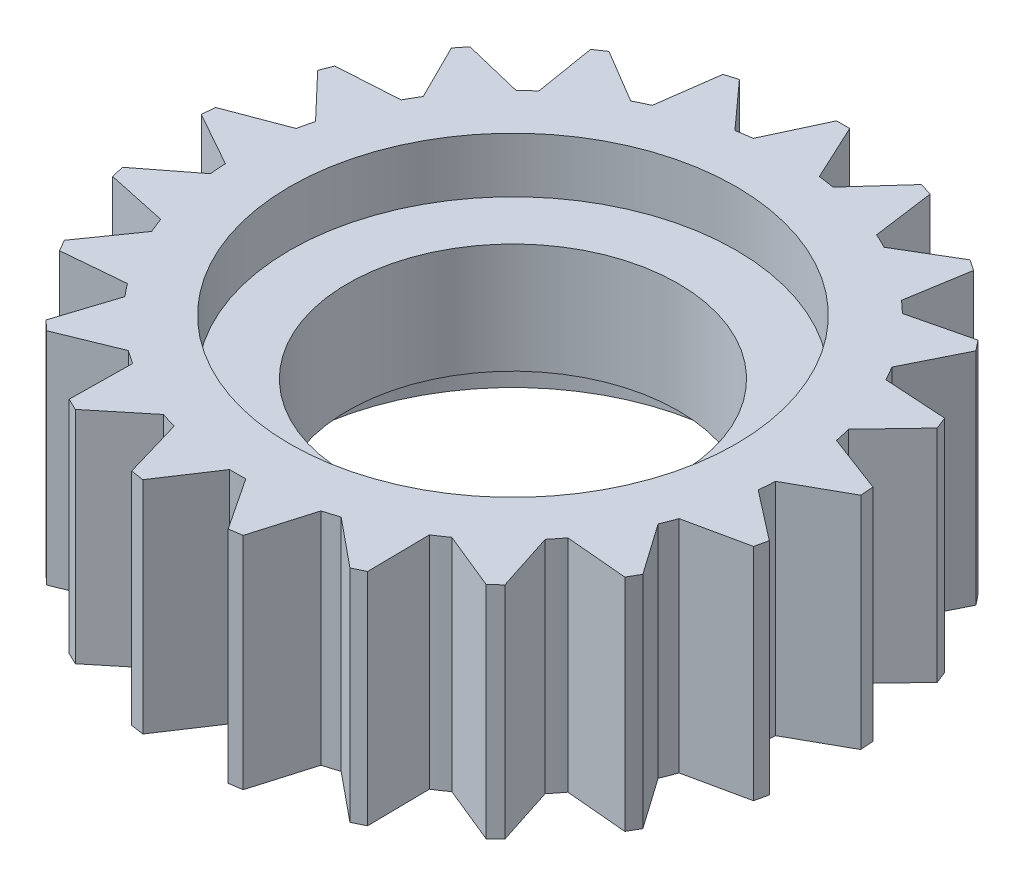
from build123d import *

# Parameters (mm, degrees)
CUT_EXTRUDE1_DEPTH      = 47.904157598
CUT_EXTRUDE1_DEPTH_BACK = 47.904157598
SKETCH2_R               = 30


with BuildPart() as part:
    # Sketch1 → Revolve1 (revolve)
    with BuildSketch(Plane(origin=(0, 0, 0), x_dir=(0, 0, -1), z_dir=(1, 0, 0))):
        Polygon((20.25, 10), (30, 10), (30, -10), (20.25, -10), (20.25, -5), (15, -5), (15, 5), (20.25, 5), align=None)
    revolve(axis=Axis((0, 0, 0), (0, 1, 0)))

    # Sketch2 → Cut-Extrude1 (cut, two sides: drawn at the far end of the back side and taken through both)
    with BuildSketch(Plane(origin=(0, 10, 0), x_dir=(1, 0, 0), z_dir=(0, 1, 0)).offset(-CUT_EXTRUDE1_DEPTH_BACK)):
        Circle(SKETCH2_R)
        with BuildLine():
            Line((-3, 24.819347292), (-0.6, 29.978082123))
            Line((-0.6, 29.978082123), (0.6, 29.978082123))
            Line((0.6, 29.978082123), (3, 24.819347292))
            ThreePointArc((3, 24.819347292), (3.726056654, 24.720770656), (4.448912622, 24.600958853))
            Line((4.448912622, 24.600958853), (8.262851141, 28.823093151))
            Line((8.262851141, 28.823093151), (9.409538508, 28.469386942))
            Line((9.409538508, 28.469386942), (10.182349457, 22.832427806))
            ThreePointArc((10.182349457, 22.832427806), (10.847093478, 22.524221698), (11.502519835, 22.19666726))
            Line((11.502519835, 22.19666726), (16.391511698, 25.107045865))
            Line((16.391511698, 25.107045865), (17.382998227, 24.431061795))
            Line((17.382998227, 24.431061795), (16.459952481, 18.816746912))
            ThreePointArc((16.459952481, 18.816746912), (17.004318444, 18.326296796), (17.534077682, 17.820104373))
            Line((17.534077682, 17.820104373), (23.063714507, 19.160127373))
            Line((23.063714507, 19.160127373), (23.811902269, 18.221929594))
            Line((23.811902269, 18.221929594), (21.275016493, 13.129115478))
            ThreePointArc((21.275016493, 13.129115478), (21.650635095, 12.5), (22.007655779, 11.86014701))
            Line((22.007655779, 11.86014701), (27.686605069, 11.510747481))
            Line((27.686605069, 11.510747481), (28.125014298, 10.393698982))
            Line((28.125014298, 10.393698982), (24.199701926, 6.274904518))
            ThreePointArc((24.199701926, 6.274904518), (24.373197805, 5.563023349), (24.525757082, 4.846363537))
            Line((24.525757082, 4.846363537), (29.849419269, 2.838587161))
            Line((29.849419269, 2.838587161), (29.939095382, 1.641942604))
            Line((29.939095382, 1.641942604), (24.974137644, -1.136859246))
            ThreePointArc((24.974137644, -1.136859246), (24.93009493, -1.86825234), (24.864637239, -2.598040603))
            Line((24.864637239, -2.598040603), (29.359981576, -6.085794085))
            Line((29.359981576, -6.085794085), (29.092956455, -7.25570758))
            Line((29.092956455, -7.25570758), (23.529511635, -8.447608076))
            ThreePointArc((23.529511635, -8.447608076), (23.271843716, -9.133525609), (22.99418526, -9.811597435))
            Line((22.99418526, -9.811597435), (26.261780675, -14.469425819))
            Line((26.261780675, -14.469425819), (25.661780675, -15.508656304))
            Line((25.661780675, -15.508656304), (19.99418526, -15.007749857))
            ThreePointArc((19.99418526, -15.007749857), (19.545787062, -15.587245046), (19.080599013, -16.153350777))
            Line((19.080599013, -16.153350777), (20.830105314, -21.567385572))
            Line((20.830105314, -21.567385572), (19.950443068, -22.383592857))
            Line((19.950443068, -22.383592857), (14.682287782, -20.234387203))
            ThreePointArc((14.682287782, -20.234387203), (14.083001452, -20.655969358), (13.471617809, -21.059808014))
            Line((13.471617809, -21.059808014), (13.547583684, -26.748988469))
            Line((13.547583684, -26.748988469), (12.466421042, -27.269648956))
            Line((12.466421042, -27.269648956), (8.065804602, -23.663110449))
            ThreePointArc((8.065804602, -23.663110449), (7.36887936, -23.889320145), (6.665624244, -24.095008891))
            Line((6.665624244, -24.095008891), (5.061299791, -29.553826355))
            Line((5.061299791, -29.553826355), (3.8747028, -29.732677074))
            Line((3.8747028, -29.732677074), (0.732639287, -24.989262488))
            ThreePointArc((0.732639287, -24.989262488), (0, -25), (-0.732639287, -24.989262488))
            Line((-0.732639287, -24.989262488), (-3.8747028, -29.732677074))
            Line((-3.8747028, -29.732677074), (-5.061299791, -29.553826355))
            Line((-5.061299791, -29.553826355), (-6.665624244, -24.095008891))
            ThreePointArc((-6.665624244, -24.095008891), (-7.36887936, -23.889320145), (-8.065804602, -23.663110449))
            Line((-8.065804602, -23.663110449), (-12.466421042, -27.269648956))
            Line((-12.466421042, -27.269648956), (-13.547583684, -26.748988469))
            Line((-13.547583684, -26.748988469), (-13.471617809, -21.059808014))
            ThreePointArc((-13.471617809, -21.059808014), (-14.083001452, -20.655969358), (-14.682287782, -20.234387203))
            Line((-14.682287782, -20.234387203), (-19.950443068, -22.383592857))
            Line((-19.950443068, -22.383592857), (-20.830105314, -21.567385572))
            Line((-20.830105314, -21.567385572), (-19.080599013, -16.153350777))
            ThreePointArc((-19.080599013, -16.153350777), (-19.545787062, -15.587245046), (-19.99418526, -15.007749857))
            Line((-19.99418526, -15.007749857), (-25.661780675, -15.508656304))
            Line((-25.661780675, -15.508656304), (-26.261780675, -14.469425819))
            Line((-26.261780675, -14.469425819), (-22.99418526, -9.811597435))
            ThreePointArc((-22.99418526, -9.811597435), (-23.271843716, -9.133525609), (-23.529511635, -8.447608076))
            Line((-23.529511635, -8.447608076), (-29.092956455, -7.25570758))
            Line((-29.092956455, -7.25570758), (-29.359981576, -6.085794085))
            Line((-29.359981576, -6.085794085), (-24.864637239, -2.598040603))
            ThreePointArc((-24.864637239, -2.598040603), (-24.93009493, -1.86825234), (-24.974137644, -1.136859246))
            Line((-24.974137644, -1.136859246), (-29.939095382, 1.641942604))
            Line((-29.939095382, 1.641942604), (-29.849419269, 2.838587161))
            Line((-29.849419269, 2.838587161), (-24.525757082, 4.846363537))
            ThreePointArc((-24.525757082, 4.846363537), (-24.373197805, 5.563023349), (-24.199701926, 6.274904518))
            Line((-24.199701926, 6.274904518), (-28.125014298, 10.393698982))
            Line((-28.125014298, 10.393698982), (-27.686605069, 11.510747481))
            Line((-27.686605069, 11.510747481), (-22.007655779, 11.86014701))
            ThreePointArc((-22.007655779, 11.86014701), (-21.650635095, 12.5), (-21.275016493, 13.129115478))
            Line((-21.275016493, 13.129115478), (-23.811902269, 18.221929594))
            Line((-23.811902269, 18.221929594), (-23.063714507, 19.160127373))
            Line((-23.063714507, 19.160127373), (-17.534077682, 17.820104373))
            ThreePointArc((-17.534077682, 17.820104373), (-17.004318444, 18.326296796), (-16.459952481, 18.816746912))
            Line((-16.459952481, 18.816746912), (-17.382998227, 24.431061795))
            Line((-17.382998227, 24.431061795), (-16.391511698, 25.107045865))
            Line((-16.391511698, 25.107045865), (-11.502519835, 22.19666726))
            ThreePointArc((-11.502519835, 22.19666726), (-10.847093478, 22.524221698), (-10.182349457, 22.832427806))
            Line((-10.182349457, 22.832427806), (-9.409538508, 28.469386942))
            Line((-9.409538508, 28.469386942), (-8.262851141, 28.823093151))
            Line((-8.262851141, 28.823093151), (-4.448912622, 24.600958853))
            ThreePointArc((-4.448912622, 24.600958853), (-3.726056654, 24.720770656), (-3, 24.819347292))
        make_face(mode=Mode.SUBTRACT)
    extrude(amount=CUT_EXTRUDE1_DEPTH + CUT_EXTRUDE1_DEPTH_BACK, mode=Mode.SUBTRACT)


solid = part.part
